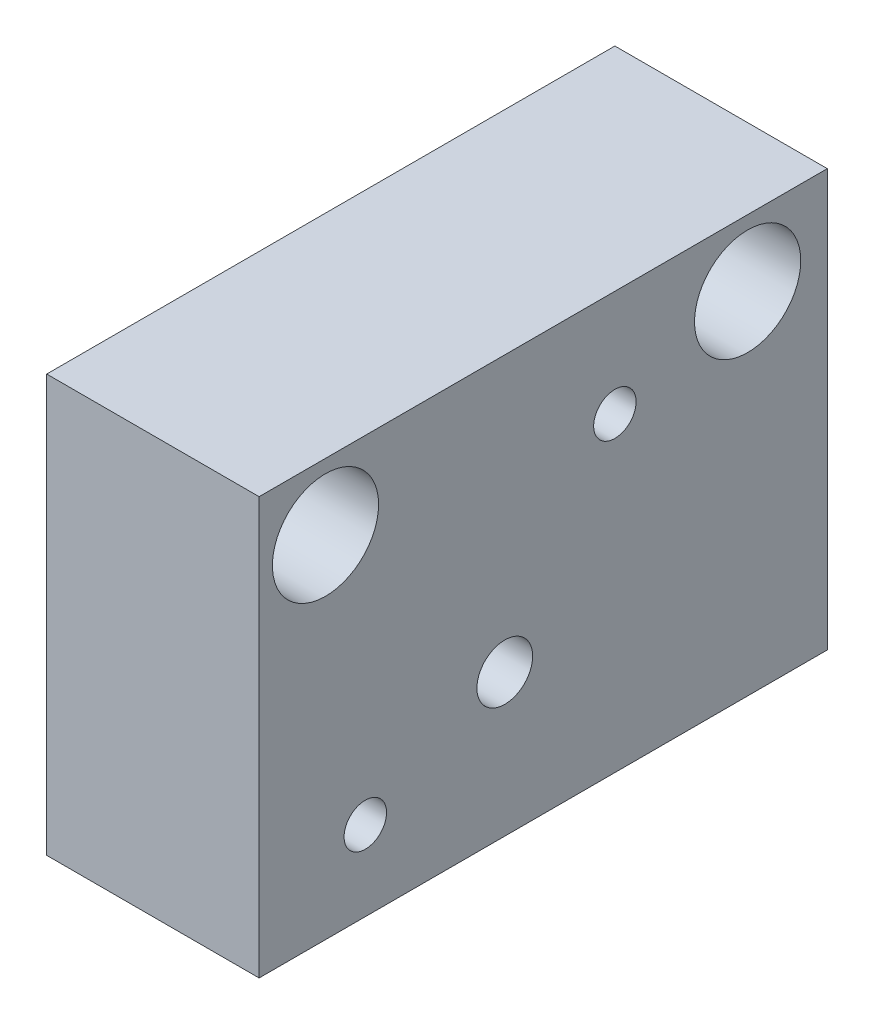
from build123d import *

# Parameters (mm, degrees)
SKETCH_1_W          = 8
SKETCH_1_H          = 21.4
EXTRUDE_1_DEPTH     = 15.7
CUT_EXTRUDE_START   = 15.7
SKETCH_1_18_R       = 2.6
CUT_EXTRUDE_1_DEPTH = 2.6
SKETCH_2_R          = 1.05
CUT_EXTRUDE_2_DEPTH = 23.443261795
SKETCH_3_R          = 2
CUT_EXTRUDE_4_DEPTH = 6
SKETCH_3_4_R        = 1.5
CUT_EXTRUDE_5_DEPTH = 23.443261795
SKETCH_4_R          = 0.8
CUT_EXTRUDE_6_DEPTH = 4
SKETCH_5_W          = 20.288493166
SKETCH_5_H          = 31.298439213
CUT_EXTRUDE_7_DEPTH = 30.490676493


with BuildPart() as part:
    # 草图1 → 凸台-拉伸1 (new body)
    with BuildSketch(Plane(origin=(0, 0, 0), x_dir=(1, 0, 0), z_dir=(0, 1, 0))):
        with Locations((0, -3.2)):
            Rectangle(SKETCH_1_W, SKETCH_1_H)
    extrude(amount=EXTRUDE_1_DEPTH)

    # 草图1<18> → 切除-拉伸1 (cut)
    with BuildSketch(Plane(origin=(0, 0, 0), x_dir=(1, 0, 0), z_dir=(0, 1, 0)).offset(CUT_EXTRUDE_START)):
        with Locations(Location((0, 0, 0), (0, 0, 90))):
            Circle(SKETCH_1_18_R)
    extrude(amount=-CUT_EXTRUDE_1_DEPTH, mode=Mode.SUBTRACT)

    # 草图2 → 切除-拉伸2 (cut, through all)
    with BuildSketch(Plane.ZY.offset(4)):
        with Locations((4.646826988, 10.35029737)):
            Circle(SKETCH_2_R)
    extrude(amount=-CUT_EXTRUDE_2_DEPTH, mode=Mode.SUBTRACT)

    # 草图3 → 切除-拉伸4 (cut)
    with BuildSketch(Plane(origin=(4, 0, 0), x_dir=(0, 0, -1), z_dir=(1, 0, 0))):
        with Locations((4.5, 2.5)):
            Circle(SKETCH_3_R)
        with Locations((-11.4, 2.5)):
            Circle(SKETCH_3_R)
    extrude(amount=-CUT_EXTRUDE_4_DEPTH, mode=Mode.SUBTRACT)

    # 草图3<4> → 切除-拉伸5 (cut, through all)
    with BuildSketch(Plane(origin=(4, 0, 0), x_dir=(0, 0, -1), z_dir=(1, 0, 0))):
        with Locations((4.5, 2.5)):
            Circle(SKETCH_3_4_R)
        with Locations((-11.4, 2.5)):
            Circle(SKETCH_3_4_R)
    extrude(amount=-CUT_EXTRUDE_5_DEPTH, mode=Mode.SUBTRACT)

    # 草图4 → 切除-拉伸6 (cut)
    with BuildSketch(Plane(origin=(4, 0, 0), x_dir=(0, 0, -1), z_dir=(1, 0, 0))):
        with Locations((-0.5, 4)):
            Circle(SKETCH_4_R)
        with Locations((-9.9, 12.7)):
            Circle(SKETCH_4_R)
    extrude(amount=-CUT_EXTRUDE_6_DEPTH, mode=Mode.SUBTRACT)


with BuildPart() as body_2:
    # 镜向1: mirrored copy
    add(part.part.mirror(Plane.ZX.offset(-10)))


with BuildPart() as part_1:
    add(part.part)

    # 草图5 → 切除-拉伸7 (cut, through all)
    with BuildSketch(Plane(origin=(0, -10, 0), x_dir=(1, 0, 0), z_dir=(0, 1, 0))):
        with Locations((1.793447893, -5.785280747)):
            Rectangle(SKETCH_5_W, SKETCH_5_H)
    extrude(amount=CUT_EXTRUDE_7_DEPTH, mode=Mode.SUBTRACT)


solid = body_2.part
